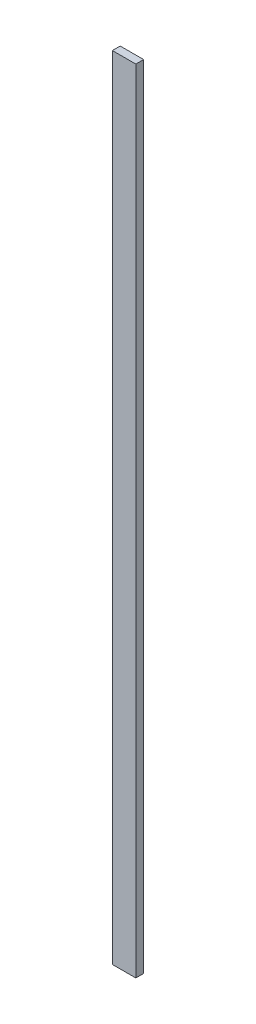
from build123d import *

# Parameters (mm, degrees)
SKETCH_1_W      = 30
SKETCH_1_H      = 1012.57
EXTRUDE_1_DEPTH = 10


with BuildPart() as part:
    # Эскиз1 → Бобышка-Вытянуть1 (new body)
    with BuildSketch(Plane.XY):
        with Locations((-440, 0)):
            Rectangle(SKETCH_1_W, SKETCH_1_H)
    extrude(amount=-EXTRUDE_1_DEPTH)


solid = part.part
